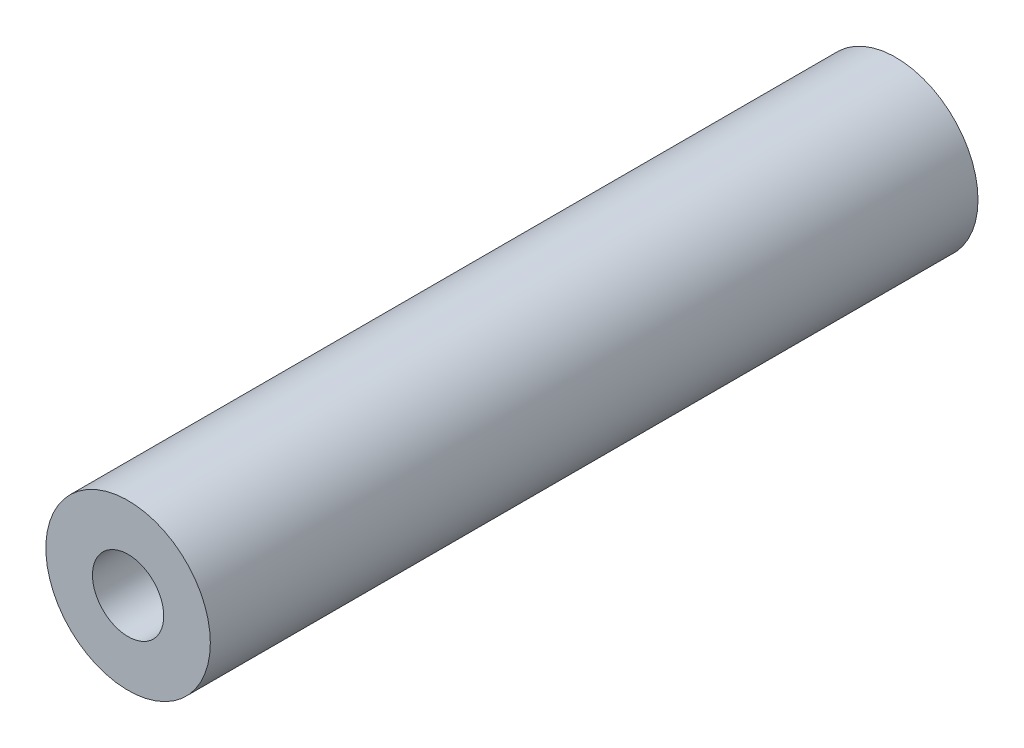
from build123d import *

# Parameters (mm, degrees)
SPACER_OD6_ID2P6_R   = 3
SPACER_OD6_ID2P6_R_2 = 1.3
REAR_GAP_28MM_DEPTH  = 28


with BuildPart() as part:
    # Spacer_OD6_ID2p6 → Rear_gap_28mm (new body)
    with BuildSketch(Plane.XY):
        Circle(SPACER_OD6_ID2P6_R)
        Circle(SPACER_OD6_ID2P6_R_2, mode=Mode.SUBTRACT)
    extrude(amount=REAR_GAP_28MM_DEPTH)


solid = part.part
